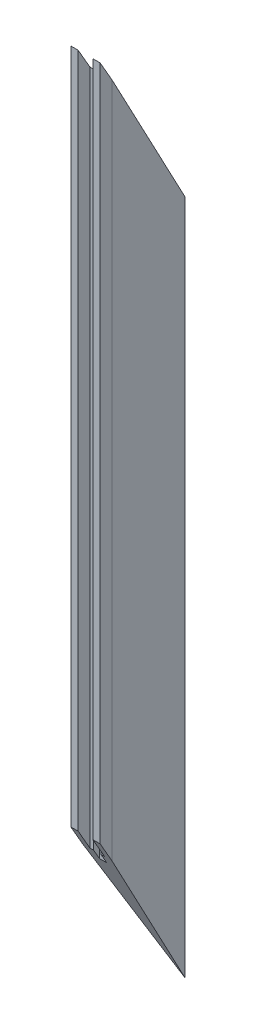
from build123d import *

# Parameters (mm, degrees)
BOSS_EXTRUDE1_DEPTH = 369.316
CUT_EXTRUDE1_DEPTH  = 17.526
CUT_EXTRUDE2_DEPTH  = 17.526


with BuildPart() as part:
    # Sketch1 → Boss-Extrude1 (new body)
    with BuildSketch(Plane(origin=(0, 0, 0), x_dir=(1, 0, 0), z_dir=(0, 1, 0))):
        Polygon((0, 38.1), (-6.35, 0), (-6.35, -5.08), (-3.175, -5.08), (-3.175, 0), (-1.5875, 0), (-1.5875, 2.54), (1.5875, 2.54), (1.5875, 0), (3.175, 0), (3.175, -5.08), (6.35, -5.08), (6.35, 0), align=None)
    extrude(amount=BOSS_EXTRUDE1_DEPTH)

    # Sketch2 → Cut-Extrude1 (cut)
    with BuildSketch(Plane.ZY.offset(6.35)):
        Polygon((5.08, 369.316), (-38.1, 294.223678497), (-38.1, 369.316), align=None)
    extrude(amount=-CUT_EXTRUDE1_DEPTH, mode=Mode.SUBTRACT)

    # Sketch3 → Cut-Extrude2 (cut)
    with BuildSketch(Plane.ZY.offset(6.35)):
        Polygon((5.08, 76.2), (-38.1, 1.107678497), (-38.1, 0), (5.08, 0), align=None)
    extrude(amount=-CUT_EXTRUDE2_DEPTH, mode=Mode.SUBTRACT)


solid = part.part
